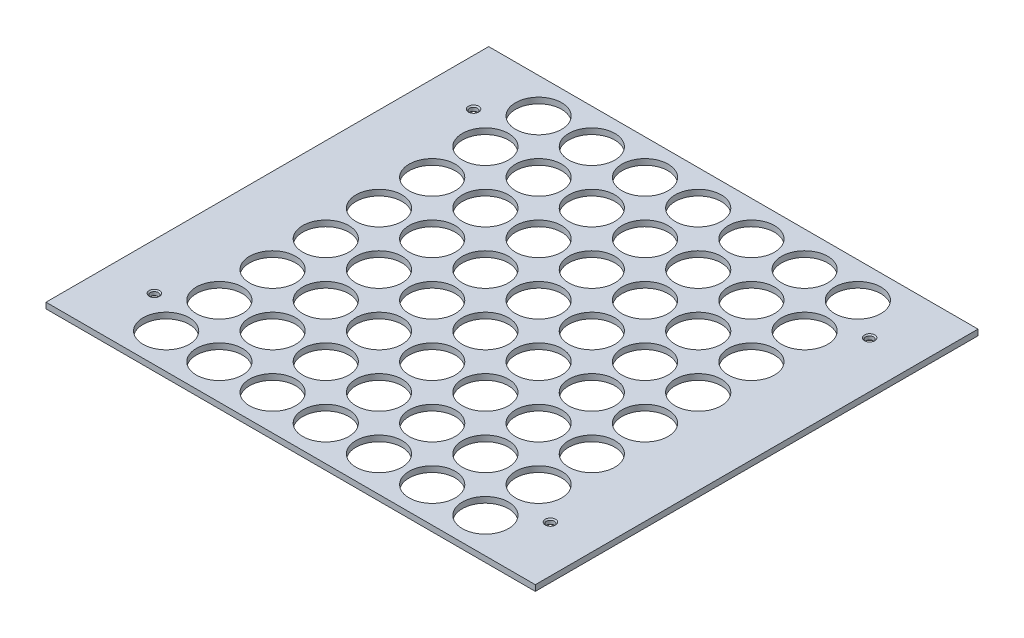
from build123d import *

# Parameters (mm, degrees)
SKETCH1_W                      = 266.7
SKETCH1_H                      = 241.3
SKETCH1_R                      = 12.573
BOSS_EXTRUDE1_DEPTH            = 3.175
F_6_CLEARANCE_HOLE1_AT_2_COUNT = 2
F_6_CLEARANCE_HOLE1_AT_2_PITCH = 215.9
F_6_CLEARANCE_HOLE1_AT_3_COUNT = 2
F_6_CLEARANCE_HOLE1_AT_3_PITCH = 277.282040709
F_6_CLEARANCE_HOLE1_AT_4_COUNT = 2
F_6_CLEARANCE_HOLE1_AT_4_PITCH = 173.99


with BuildPart() as part:
    # Sketch1 → Boss-Extrude1 (new body)
    with BuildSketch(Plane(origin=(0, 0, 0), x_dir=(1, 0, 0), z_dir=(0, 1, 0))):
        Rectangle(SKETCH1_W, SKETCH1_H)
        with Locations(Location((-87, -101.5, 0), (0, 0, 270))):
            Circle(SKETCH1_R, mode=Mode.SUBTRACT)
        with Locations(Location((-58, -101.5, 0), (0, 0, 270))):
            Circle(SKETCH1_R, mode=Mode.SUBTRACT)
        with Locations(Location((-29, -101.5, 0), (0, 0, 270))):
            Circle(SKETCH1_R, mode=Mode.SUBTRACT)
        with Locations(Location((0, -101.5, 0), (0, 0, 270))):
            Circle(SKETCH1_R, mode=Mode.SUBTRACT)
        with Locations(Location((29, -101.5, 0), (0, 0, 270))):
            Circle(SKETCH1_R, mode=Mode.SUBTRACT)
        with Locations(Location((58, -101.5, 0), (0, 0, 270))):
            Circle(SKETCH1_R, mode=Mode.SUBTRACT)
        with Locations(Location((87, -101.5, 0), (0, 0, 270))):
            Circle(SKETCH1_R, mode=Mode.SUBTRACT)
        with Locations(Location((-58, -72.5, 0), (0, 0, 270))):
            Circle(SKETCH1_R, mode=Mode.SUBTRACT)
        with Locations(Location((-29, -72.5, 0), (0, 0, 270))):
            Circle(SKETCH1_R, mode=Mode.SUBTRACT)
        with Locations(Location((0, -72.5, 0), (0, 0, 270))):
            Circle(SKETCH1_R, mode=Mode.SUBTRACT)
        with Locations(Location((29, -72.5, 0), (0, 0, 270))):
            Circle(SKETCH1_R, mode=Mode.SUBTRACT)
        with Locations(Location((58, -72.5, 0), (0, 0, 270))):
            Circle(SKETCH1_R, mode=Mode.SUBTRACT)
        with Locations(Location((87, -72.5, 0), (0, 0, 270))):
            Circle(SKETCH1_R, mode=Mode.SUBTRACT)
        with Locations(Location((-58, -43.5, 0), (0, 0, 270))):
            Circle(SKETCH1_R, mode=Mode.SUBTRACT)
        with Locations(Location((-29, -43.5, 0), (0, 0, 270))):
            Circle(SKETCH1_R, mode=Mode.SUBTRACT)
        with Locations(Location((0, -43.5, 0), (0, 0, 270))):
            Circle(SKETCH1_R, mode=Mode.SUBTRACT)
        with Locations(Location((29, -43.5, 0), (0, 0, 270))):
            Circle(SKETCH1_R, mode=Mode.SUBTRACT)
        with Locations(Location((58, -43.5, 0), (0, 0, 270))):
            Circle(SKETCH1_R, mode=Mode.SUBTRACT)
        with Locations(Location((87, -43.5, 0), (0, 0, 270))):
            Circle(SKETCH1_R, mode=Mode.SUBTRACT)
        with Locations(Location((-58, -14.5, 0), (0, 0, 270))):
            Circle(SKETCH1_R, mode=Mode.SUBTRACT)
        with Locations(Location((-29, -14.5, 0), (0, 0, 270))):
            Circle(SKETCH1_R, mode=Mode.SUBTRACT)
        with Locations(Location((0, -14.5, 0), (0, 0, 270))):
            Circle(SKETCH1_R, mode=Mode.SUBTRACT)
        with Locations(Location((29, -14.5, 0), (0, 0, 270))):
            Circle(SKETCH1_R, mode=Mode.SUBTRACT)
        with Locations(Location((58, -14.5, 0), (0, 0, 270))):
            Circle(SKETCH1_R, mode=Mode.SUBTRACT)
        with Locations(Location((87, -14.5, 0), (0, 0, 270))):
            Circle(SKETCH1_R, mode=Mode.SUBTRACT)
        with Locations(Location((-58, 14.5, 0), (0, 0, 270))):
            Circle(SKETCH1_R, mode=Mode.SUBTRACT)
        with Locations(Location((-29, 14.5, 0), (0, 0, 270))):
            Circle(SKETCH1_R, mode=Mode.SUBTRACT)
        with Locations(Location((0, 14.5, 0), (0, 0, 270))):
            Circle(SKETCH1_R, mode=Mode.SUBTRACT)
        with Locations(Location((29, 14.5, 0), (0, 0, 270))):
            Circle(SKETCH1_R, mode=Mode.SUBTRACT)
        with Locations(Location((58, 14.5, 0), (0, 0, 270))):
            Circle(SKETCH1_R, mode=Mode.SUBTRACT)
        with Locations(Location((87, 14.5, 0), (0, 0, 270))):
            Circle(SKETCH1_R, mode=Mode.SUBTRACT)
        with Locations(Location((-58, 43.5, 0), (0, 0, 270))):
            Circle(SKETCH1_R, mode=Mode.SUBTRACT)
        with Locations(Location((-29, 43.5, 0), (0, 0, 270))):
            Circle(SKETCH1_R, mode=Mode.SUBTRACT)
        with Locations(Location((0, 43.5, 0), (0, 0, 270))):
            Circle(SKETCH1_R, mode=Mode.SUBTRACT)
        with Locations(Location((29, 43.5, 0), (0, 0, 270))):
            Circle(SKETCH1_R, mode=Mode.SUBTRACT)
        with Locations(Location((58, 43.5, 0), (0, 0, 270))):
            Circle(SKETCH1_R, mode=Mode.SUBTRACT)
        with Locations(Location((87, 43.5, 0), (0, 0, 270))):
            Circle(SKETCH1_R, mode=Mode.SUBTRACT)
        with Locations(Location((-58, 72.5, 0), (0, 0, 270))):
            Circle(SKETCH1_R, mode=Mode.SUBTRACT)
        with Locations(Location((-29, 72.5, 0), (0, 0, 270))):
            Circle(SKETCH1_R, mode=Mode.SUBTRACT)
        with Locations(Location((0, 72.5, 0), (0, 0, 270))):
            Circle(SKETCH1_R, mode=Mode.SUBTRACT)
        with Locations(Location((29, 72.5, 0), (0, 0, 270))):
            Circle(SKETCH1_R, mode=Mode.SUBTRACT)
        with Locations(Location((58, 72.5, 0), (0, 0, 270))):
            Circle(SKETCH1_R, mode=Mode.SUBTRACT)
        with Locations(Location((87, 72.5, 0), (0, 0, 270))):
            Circle(SKETCH1_R, mode=Mode.SUBTRACT)
        with Locations(Location((-58, 101.5, 0), (0, 0, 270))):
            Circle(SKETCH1_R, mode=Mode.SUBTRACT)
        with Locations(Location((-29, 101.5, 0), (0, 0, 270))):
            Circle(SKETCH1_R, mode=Mode.SUBTRACT)
        with Locations(Location((0, 101.5, 0), (0, 0, 270))):
            Circle(SKETCH1_R, mode=Mode.SUBTRACT)
        with Locations(Location((29, 101.5, 0), (0, 0, 270))):
            Circle(SKETCH1_R, mode=Mode.SUBTRACT)
        with Locations(Location((58, 101.5, 0), (0, 0, 270))):
            Circle(SKETCH1_R, mode=Mode.SUBTRACT)
        with Locations(Location((87, 101.5, 0), (0, 0, 270))):
            Circle(SKETCH1_R, mode=Mode.SUBTRACT)
        with Locations(Location((-87, -72.5, 0), (0, 0, 270))):
            Circle(SKETCH1_R, mode=Mode.SUBTRACT)
        with Locations(Location((-87, -43.5, 0), (0, 0, 270))):
            Circle(SKETCH1_R, mode=Mode.SUBTRACT)
        with Locations(Location((-87, -14.5, 0), (0, 0, 270))):
            Circle(SKETCH1_R, mode=Mode.SUBTRACT)
        with Locations(Location((-87, 14.5, 0), (0, 0, 270))):
            Circle(SKETCH1_R, mode=Mode.SUBTRACT)
        with Locations(Location((-87, 43.5, 0), (0, 0, 270))):
            Circle(SKETCH1_R, mode=Mode.SUBTRACT)
        with Locations(Location((-87, 72.5, 0), (0, 0, 270))):
            Circle(SKETCH1_R, mode=Mode.SUBTRACT)
        with Locations(Location((-87, 101.5, 0), (0, 0, 270))):
            Circle(SKETCH1_R, mode=Mode.SUBTRACT)
    extrude(amount=BOSS_EXTRUDE1_DEPTH)

    # Sketch4 → #6 Clearance Hole1 (revolve, cut)
    with BuildSketch(Plane(origin=(-107.95, 3.175, -86.995), x_dir=(0, 0, 1), z_dir=(1, 0, 0))):
        Polygon((0, 0), (0, 3.175), (2.78765, 3.175), (2.15265, 2.54), (2.15265, 0.635), (2.78765, 0), align=None)
    f_6_clearance_hole1 = revolve(axis=Axis((-107.95, 9.525, -86.995), (0, -1, 0)), mode=Mode.SUBTRACT)

    # #6 Clearance Hole1 at 2: #6 Clearance Hole1 ×2
    with Locations(*[(i * F_6_CLEARANCE_HOLE1_AT_2_PITCH, 0, 0) for i in range(1, F_6_CLEARANCE_HOLE1_AT_2_COUNT)]):
        add(f_6_clearance_hole1, mode=Mode.SUBTRACT)

    # #6 Clearance Hole1 at 3: #6 Clearance Hole1 ×2
    with Locations(*[Vector(0.7786295839701597, 0, 0.6274838411994815) * (i * F_6_CLEARANCE_HOLE1_AT_3_PITCH) for i in range(1, F_6_CLEARANCE_HOLE1_AT_3_COUNT)]):
        add(f_6_clearance_hole1, mode=Mode.SUBTRACT)

    # #6 Clearance Hole1 at 4: #6 Clearance Hole1 ×2
    with Locations(*[(0, 0, i * F_6_CLEARANCE_HOLE1_AT_4_PITCH) for i in range(1, F_6_CLEARANCE_HOLE1_AT_4_COUNT)]):
        add(f_6_clearance_hole1, mode=Mode.SUBTRACT)


solid = part.part
